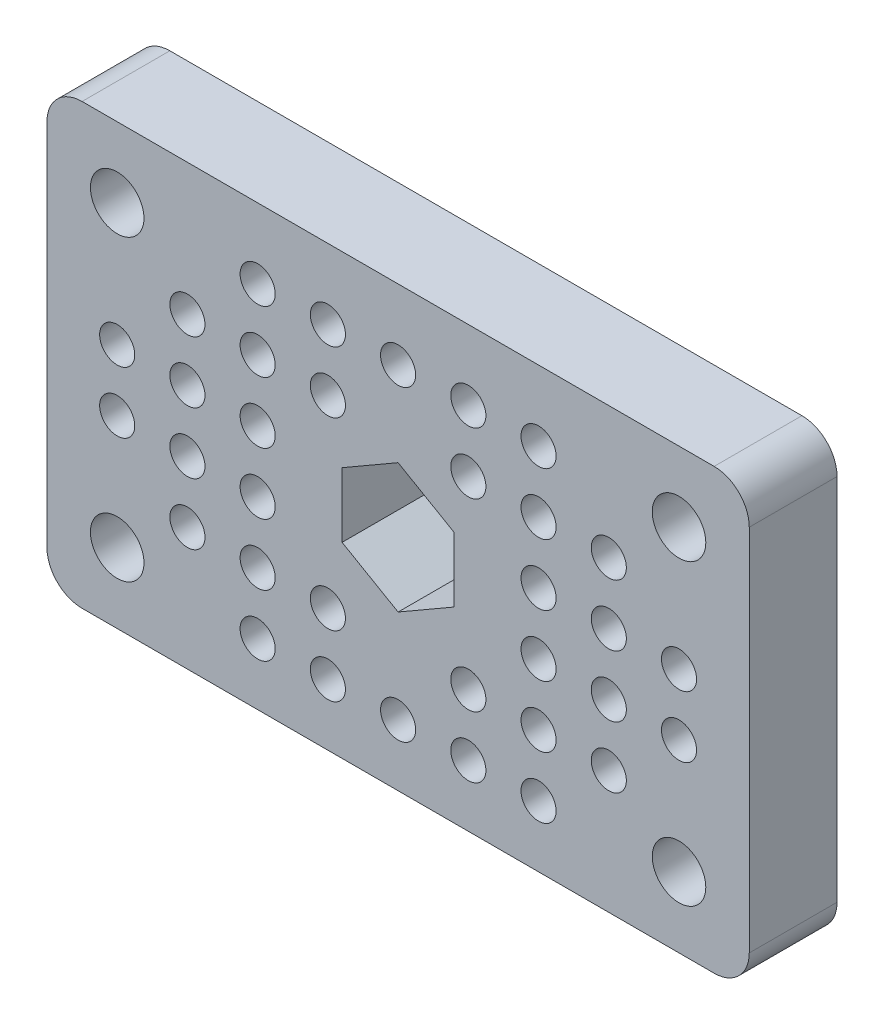
from build123d import *

# Parameters (mm, degrees)
MODEL_R             = 3.05
MODEL_R_2           = 2
BOSS_EXTRUDE1_DEPTH = 10


with BuildPart() as part:
    # Model → Boss-Extrude1 (new body)
    with BuildSketch(Plane.XY):
        with BuildLine():
            Line((-36, -25), (36, -25))
            ThreePointArc((36, -25), (38.828427125, -23.828427125), (40, -21))
            Line((40, -21), (40, 21))
            ThreePointArc((40, 21), (38.828427125, 23.828427125), (36, 25))
            Line((36, 25), (-36, 25))
            ThreePointArc((-36, 25), (-38.828427125, 23.828427125), (-40, 21))
            Line((-40, 21), (-40, -21))
            ThreePointArc((-40, -21), (-38.828427125, -23.828427125), (-36, -25))
        make_face()
        with Locations((-32, 17)):
            Circle(MODEL_R, mode=Mode.SUBTRACT)
        with Locations((32, -17)):
            Circle(MODEL_R, mode=Mode.SUBTRACT)
        with Locations((32, 17)):
            Circle(MODEL_R, mode=Mode.SUBTRACT)
        with Locations((-32, -17)):
            Circle(MODEL_R, mode=Mode.SUBTRACT)
        with Locations((-16, 17)):
            Circle(MODEL_R_2, mode=Mode.SUBTRACT)
        with Locations((16, 10)):
            Circle(MODEL_R_2, mode=Mode.SUBTRACT)
        with Locations((24, 10)):
            Circle(MODEL_R_2, mode=Mode.SUBTRACT)
        with Locations((-16, 3)):
            Circle(MODEL_R_2, mode=Mode.SUBTRACT)
        with Locations((-32, -4)):
            Circle(MODEL_R_2, mode=Mode.SUBTRACT)
        with Locations((32, 3)):
            Circle(MODEL_R_2, mode=Mode.SUBTRACT)
        with Locations((-16, -4)):
            Circle(MODEL_R_2, mode=Mode.SUBTRACT)
        with Locations((24, 3)):
            Circle(MODEL_R_2, mode=Mode.SUBTRACT)
        with Locations((16, 3)):
            Circle(MODEL_R_2, mode=Mode.SUBTRACT)
        with Locations((-16, 10)):
            Circle(MODEL_R_2, mode=Mode.SUBTRACT)
        with Locations((-8, 10)):
            Circle(MODEL_R_2, mode=Mode.SUBTRACT)
        with Locations((-32, 3)):
            Circle(MODEL_R_2, mode=Mode.SUBTRACT)
        with Locations((8, 10)):
            Circle(MODEL_R_2, mode=Mode.SUBTRACT)
        with Locations((16, 17)):
            Circle(MODEL_R_2, mode=Mode.SUBTRACT)
        with Locations((8, 17)):
            Circle(MODEL_R_2, mode=Mode.SUBTRACT)
        with Locations((0, 17)):
            Circle(MODEL_R_2, mode=Mode.SUBTRACT)
        with Locations((-8, 17)):
            Circle(MODEL_R_2, mode=Mode.SUBTRACT)
        with Locations((-16, -18)):
            Circle(MODEL_R_2, mode=Mode.SUBTRACT)
        with Locations((-8, -18)):
            Circle(MODEL_R_2, mode=Mode.SUBTRACT)
        with Locations((0, -18)):
            Circle(MODEL_R_2, mode=Mode.SUBTRACT)
        with Locations((8, -18)):
            Circle(MODEL_R_2, mode=Mode.SUBTRACT)
        with Locations((-24, -11)):
            Circle(MODEL_R_2, mode=Mode.SUBTRACT)
        with Locations((-24, -4)):
            Circle(MODEL_R_2, mode=Mode.SUBTRACT)
        with Locations((-24, 3)):
            Circle(MODEL_R_2, mode=Mode.SUBTRACT)
        with Locations((-24, 10)):
            Circle(MODEL_R_2, mode=Mode.SUBTRACT)
        with Locations((16, -18)):
            Circle(MODEL_R_2, mode=Mode.SUBTRACT)
        with Locations((-16, -11)):
            Circle(MODEL_R_2, mode=Mode.SUBTRACT)
        with Locations((24, -4)):
            Circle(MODEL_R_2, mode=Mode.SUBTRACT)
        with Locations((16, -4)):
            Circle(MODEL_R_2, mode=Mode.SUBTRACT)
        with Locations((32, -4)):
            Circle(MODEL_R_2, mode=Mode.SUBTRACT)
        with Locations((-8, -11)):
            Circle(MODEL_R_2, mode=Mode.SUBTRACT)
        with Locations((8, -11)):
            Circle(MODEL_R_2, mode=Mode.SUBTRACT)
        with Locations((16, -11)):
            Circle(MODEL_R_2, mode=Mode.SUBTRACT)
        with Locations((24, -11)):
            Circle(MODEL_R_2, mode=Mode.SUBTRACT)
        Polygon((6.380023856, -3.683453397), (6.379976144, 3.683536037), (-4.7712e-05, 7.366989435), (-6.380023856, 3.683453397), (-6.379976144, -3.683536037), (4.7712e-05, -7.366989435), align=None, mode=Mode.SUBTRACT)
    extrude(amount=BOSS_EXTRUDE1_DEPTH)


solid = part.part
